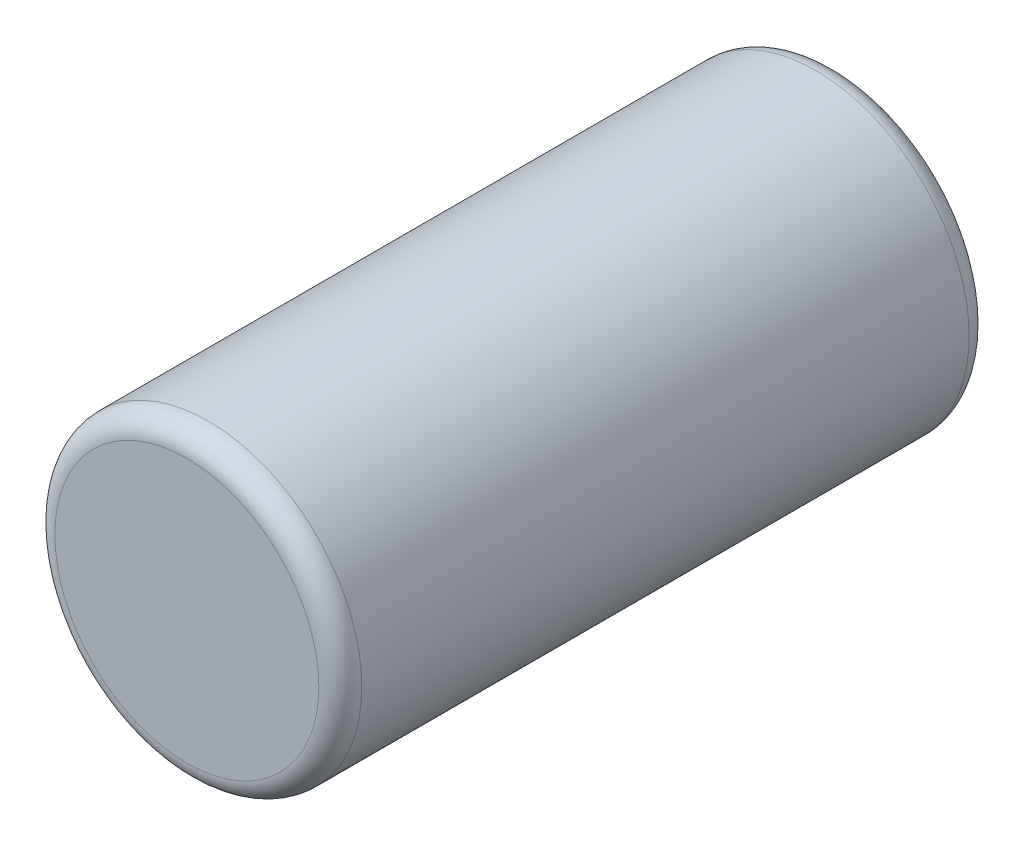
from build123d import *


with BuildPart() as part:
    # Sketch1 → Revolve1 (revolve)
    with BuildSketch(Plane(origin=(0, 0, 0), x_dir=(0, 0, -1), z_dir=(1, 0, 0)), mode=Mode.PRIVATE) as revolve1_sk:
        with BuildLine():
            Line((0, 0), (0, 6.15))
            ThreePointArc((0, 6.15), (0.292893219, 6.857106781), (1, 7.15))
            Line((1, 7.15), (29.3, 7.15))
            ThreePointArc((29.3, 7.15), (30.007106781, 6.857106781), (30.3, 6.15))
            Line((30.3, 6.15), (30.3, 0))
            Line((30.3, 0), (0, 0))
        make_face()
    revolve(revolve1_sk.sketch.rotate(Axis((0, 0, 0), (0, 0, -1)), 90), axis=Axis((0, 0, 0), (0, 0, -1)))


solid = part.part
